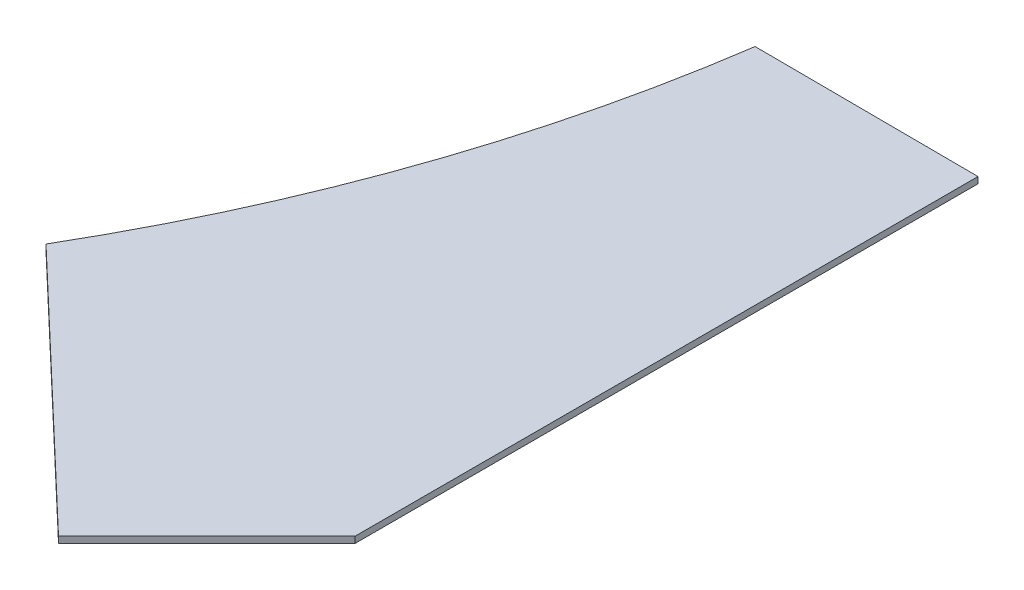
from build123d import *

# Parameters (mm, degrees)
BASEPLATE_PROFILE_DEPTH               = 2
SKETCH2_R                             = 1
M3_PINS_DEPTH                         = 5
M3_PINS_TAPER                         = 7
CIRPATTERN1_COUNT                     = 32
SKETCH4_R                             = 1
PILLAR_PINS_DEPTH                     = 5
PILLAR_PINS_DRAFT                     = 6
PILLAR_PINS_PROFILE_2_DEPTH           = 5
PILLAR_PINS_PROFILE_2_DRAFT           = 6
CIRPATTERN2_COPY_1_SKETCH_R           = 1
CIRPATTERN2_COPY_1_DEPTH              = 5
CIRPATTERN2_COPY_1_DRAFT              = 6
CIRPATTERN2_COPY_2_SKETCH_R           = 1
CIRPATTERN2_COPY_2_DEPTH              = 5
CIRPATTERN2_COPY_2_DRAFT              = 6
CIRPATTERN2_COPY_3_SKETCH_R           = 1
CIRPATTERN2_COPY_3_DEPTH              = 5
CIRPATTERN2_COPY_3_DRAFT              = 6
CIRPATTERN2_COPY_4_SKETCH_R           = 1
CIRPATTERN2_COPY_4_DEPTH              = 5
CIRPATTERN2_COPY_4_DRAFT              = 6
CIRPATTERN2_COPY_5_SKETCH_R           = 1
CIRPATTERN2_COPY_5_DEPTH              = 5
CIRPATTERN2_COPY_5_DRAFT              = 6
CIRPATTERN2_COPY_6_SKETCH_R           = 1
CIRPATTERN2_COPY_6_DEPTH              = 5
CIRPATTERN2_COPY_6_DRAFT              = 6
CIRPATTERN2_COPY_7_SKETCH_R           = 1
CIRPATTERN2_COPY_7_DEPTH              = 5
CIRPATTERN2_COPY_7_DRAFT              = 6
CIRPATTERN2_COPY_8_SKETCH_R           = 1
CIRPATTERN2_COPY_8_DEPTH              = 5
CIRPATTERN2_COPY_8_DRAFT              = 6
CIRPATTERN2_COPY_9_SKETCH_R           = 1
CIRPATTERN2_COPY_9_DEPTH              = 5
CIRPATTERN2_COPY_9_DRAFT              = 6
CIRPATTERN2_COPY_10_SKETCH_R          = 1
CIRPATTERN2_COPY_10_DEPTH             = 5
CIRPATTERN2_COPY_10_DRAFT             = 6
CIRPATTERN2_COPY_11_SKETCH_R          = 1
CIRPATTERN2_COPY_11_DEPTH             = 5
CIRPATTERN2_COPY_11_DRAFT             = 6
CIRPATTERN2_COPY_12_SKETCH_R          = 1
CIRPATTERN2_COPY_12_DEPTH             = 5
CIRPATTERN2_COPY_12_DRAFT             = 6
CIRPATTERN2_COPY_13_SKETCH_R          = 1
CIRPATTERN2_COPY_13_DEPTH             = 5
CIRPATTERN2_COPY_13_DRAFT             = 6
CIRPATTERN2_COPY_14_SKETCH_R          = 1
CIRPATTERN2_COPY_14_DEPTH             = 5
CIRPATTERN2_COPY_14_DRAFT             = 6
CIRPATTERN2_COPY_15_SKETCH_R          = 1
CIRPATTERN2_COPY_15_DEPTH             = 5
CIRPATTERN2_COPY_15_DRAFT             = 6
SKETCH5_R                             = 3
M8_HOLE_1_DEPTH                       = 5
M8_HOLE_1_TAPER                       = 12
M8_1_PATTERN_COUNT                    = 4
SKETCH6_R                             = 3
EXTRUDE_M8_2_DEPTH                    = 5
EXTRUDE_M8_2_TAPER                    = 12
M8_2_PATTERN_COUNT                    = 4
PATTERN_CIRCULAR_M8_3_COUNT           = 2
PATTERN_CIRCULAR_M8_3_ANGLE           = 36.9
PATTERN_CIRCULAR_M8_3_COPY_1_SKETCH_R = 3
PATTERN_CIRCULAR_M8_3_COPY_1_DEPTH    = 5
PATTERN_CIRCULAR_M8_3_COPY_1_TAPER    = 12
PATTERN_CIRCULAR_M8_3_COPY_2_SKETCH_R = 3
PATTERN_CIRCULAR_M8_3_COPY_2_DEPTH    = 5
PATTERN_CIRCULAR_M8_3_COPY_2_TAPER    = 12
PATTERN_CIRCULAR_M8_3_COPY_3_SKETCH_R = 3
PATTERN_CIRCULAR_M8_3_COPY_3_DEPTH    = 5
PATTERN_CIRCULAR_M8_3_COPY_3_TAPER    = 12
CUT_CENTER_DEPTH                      = 374.385859402
CIRPATTERN7_COUNT                     = 6
SKETCH16_W                            = 706.015434107
SKETCH16_H                            = 962.246603821
SKETCH16_W_2                          = 199
SKETCH16_H_2                          = 199
CUT_EXTRUDE4_DEPTH                    = 374.417996354
CUT_EXTRUDE5_DEPTH                    = 374.385859402
BOSS_EXTRUDE3_DEPTH                   = 2
BOSS_EXTRUDE4_DEPTH                   = 1
SKETCH21_W                            = 326.425161963
SKETCH21_H                            = 364.538398874
CUT_EXTRUDE6_DEPTH                    = 374.417996354


with BuildPart() as part:
    # Sketch1 → baseplate profile (new body)
    with BuildSketch(Plane(origin=(0, 0, 0), x_dir=(1, 0, 0), z_dir=(0, 1, 0))):
        Polygon((264, 0), (264, 131.98), (131.979594929, 264), (0, 264), (-131.98, 264), (-264, 131.979594929), (-264, 0), (-264, -131.98), (-131.979594929, -264), (0, -264), (131.98, -264), (264, -131.979594929), align=None)
    extrude(amount=-BASEPLATE_PROFILE_DEPTH)

    # Sketch2 → M3 pins (add)
    with BuildSketch(Plane(origin=(0, 0, 0), x_dir=(1, 0, 0), z_dir=(0, 1, 0))):
        with Locations((0, 248)):
            Circle(SKETCH2_R)
    m3_pins = extrude(amount=M3_PINS_DEPTH, taper=M3_PINS_TAPER)

    # CirPattern1: M3 pins ×32 about axis
    cirpattern1_axis = Axis((0, 0, 0), (0, 1, 0))
    for i in range(1, CIRPATTERN1_COUNT):
        add(m3_pins.rotate(cirpattern1_axis, i * 360 / CIRPATTERN1_COUNT))


with BuildPart() as pillar_pins_tool:
    # Sketch4 → pillar pins (with draft: the straight prism first)
    with BuildSketch(Plane(origin=(0, 0, 0), x_dir=(1, 0, 0), z_dir=(0, 1, 0))):
        with Locations((9, 201)):
            Circle(SKETCH4_R)
    extrude(amount=PILLAR_PINS_DEPTH)
    # pillar pins: the draft: its side faces are tilted about the plane it starts from
    pillar_pins_sides = [pillar_pins_tool.faces().sort_by_distance(p)[0] for p in [
        (8, 2.5, -201),
    ]]
    draft(pillar_pins_sides, Plane(origin=(0, 0, 0), x_dir=(1, 0, 0), z_dir=(0, 1, 0)), PILLAR_PINS_DRAFT)


with BuildPart() as part_1:
    add(part.part)

    # pillar pins: add pillar_pins_tool
    add(pillar_pins_tool.part)


with BuildPart() as pillar_pins_profile_2_tool:
    # Sketch4 → pillar pins profile 2 (with draft: the straight prism first)
    with BuildSketch(Plane(origin=(0, 0, 0), x_dir=(1, 0, 0), z_dir=(0, 1, 0))):
        with Locations((-9, 201)):
            Circle(SKETCH4_R)
    extrude(amount=PILLAR_PINS_PROFILE_2_DEPTH)
    # pillar pins profile 2: the draft: its side faces are tilted about the plane it starts from
    pillar_pins_profile_2_sides = [pillar_pins_profile_2_tool.faces().sort_by_distance(p)[0] for p in [
        (-10, 2.5, -201),
    ]]
    draft(pillar_pins_profile_2_sides, Plane(origin=(0, 0, 0), x_dir=(1, 0, 0), z_dir=(0, 1, 0)), PILLAR_PINS_PROFILE_2_DRAFT)


with BuildPart() as part_2:
    add(part_1.part)

    # pillar pins profile 2: add pillar_pins_profile_2_tool
    add(pillar_pins_profile_2_tool.part)


with BuildPart() as cirpattern2_copy_1_tool:
    # CirPattern2 copy 1 sketch → CirPattern2 copy 1 (with draft: the straight prism first)
    with BuildSketch(Plane(origin=(0, 0, 0), x_dir=(0.5000000000000001, 0, -0.8660254037844386), z_dir=(0, 1, 0))):
        with Locations((9, 201)):
            Circle(CIRPATTERN2_COPY_1_SKETCH_R)
    extrude(amount=CIRPATTERN2_COPY_1_DEPTH)
    # CirPattern2 copy 1: the draft: its side faces are tilted about the plane it starts from
    cirpattern2_copy_1_sides = [cirpattern2_copy_1_tool.faces().sort_by_distance(p)[0] for p in [
        (-170.071106161, 2.5, -107.42820323),
    ]]
    draft(cirpattern2_copy_1_sides, Plane(origin=(0, 0, 0), x_dir=(0.5000000000000001, 0, -0.8660254037844386), z_dir=(0, 1, 0)), CIRPATTERN2_COPY_1_DRAFT)


with BuildPart() as part_3:
    add(part_2.part)

    # CirPattern2 copy 1: add cirpattern2_copy_1_tool
    add(cirpattern2_copy_1_tool.part)


with BuildPart() as cirpattern2_copy_2_tool:
    # CirPattern2 copy 2 sketch → CirPattern2 copy 2 (with draft: the straight prism first)
    with BuildSketch(Plane(origin=(0, 0, 0), x_dir=(-0.4999999999999998, 0, -0.8660254037844387), z_dir=(0, 1, 0))):
        with Locations((9, 201)):
            Circle(CIRPATTERN2_COPY_2_SKETCH_R)
    extrude(amount=CIRPATTERN2_COPY_2_DEPTH)
    # CirPattern2 copy 2: the draft: its side faces are tilted about the plane it starts from
    cirpattern2_copy_2_sides = [cirpattern2_copy_2_tool.faces().sort_by_distance(p)[0] for p in [
        (-178.071106161, 2.5, 93.57179677),
    ]]
    draft(cirpattern2_copy_2_sides, Plane(origin=(0, 0, 0), x_dir=(-0.4999999999999998, 0, -0.8660254037844387), z_dir=(0, 1, 0)), CIRPATTERN2_COPY_2_DRAFT)


with BuildPart() as part_4:
    add(part_3.part)

    # CirPattern2 copy 2: add cirpattern2_copy_2_tool
    add(cirpattern2_copy_2_tool.part)


with BuildPart() as cirpattern2_copy_3_tool:
    # CirPattern2 copy 3 sketch → CirPattern2 copy 3 (with draft: the straight prism first)
    with BuildSketch(Plane(origin=(0, 0, 0), x_dir=(-1, 0, 0), z_dir=(0, 1, 0))):
        with Locations((9, 201)):
            Circle(CIRPATTERN2_COPY_3_SKETCH_R)
    extrude(amount=CIRPATTERN2_COPY_3_DEPTH)
    # CirPattern2 copy 3: the draft: its side faces are tilted about the plane it starts from
    cirpattern2_copy_3_sides = [cirpattern2_copy_3_tool.faces().sort_by_distance(p)[0] for p in [
        (-8, 2.5, 201),
    ]]
    draft(cirpattern2_copy_3_sides, Plane(origin=(0, 0, 0), x_dir=(-1, 0, 0), z_dir=(0, 1, 0)), CIRPATTERN2_COPY_3_DRAFT)


with BuildPart() as part_5:
    add(part_4.part)

    # CirPattern2 copy 3: add cirpattern2_copy_3_tool
    add(cirpattern2_copy_3_tool.part)


with BuildPart() as cirpattern2_copy_4_tool:
    # CirPattern2 copy 4 sketch → CirPattern2 copy 4 (with draft: the straight prism first)
    with BuildSketch(Plane(origin=(0, 0, 0), x_dir=(-0.5000000000000004, 0, 0.8660254037844384), z_dir=(0, 1, 0))):
        with Locations((9, 201)):
            Circle(CIRPATTERN2_COPY_4_SKETCH_R)
    extrude(amount=CIRPATTERN2_COPY_4_DEPTH)
    # CirPattern2 copy 4: the draft: its side faces are tilted about the plane it starts from
    cirpattern2_copy_4_sides = [cirpattern2_copy_4_tool.faces().sort_by_distance(p)[0] for p in [
        (170.071106161, 2.5, 107.42820323),
    ]]
    draft(cirpattern2_copy_4_sides, Plane(origin=(0, 0, 0), x_dir=(-0.5000000000000004, 0, 0.8660254037844384), z_dir=(0, 1, 0)), CIRPATTERN2_COPY_4_DRAFT)


with BuildPart() as part_6:
    add(part_5.part)

    # CirPattern2 copy 4: add cirpattern2_copy_4_tool
    add(cirpattern2_copy_4_tool.part)


with BuildPart() as cirpattern2_copy_5_tool:
    # CirPattern2 copy 5 sketch → CirPattern2 copy 5 (with draft: the straight prism first)
    with BuildSketch(Plane(origin=(0, 0, 0), x_dir=(0.5000000000000001, 0, 0.8660254037844386), z_dir=(0, 1, 0))):
        with Locations((9, 201)):
            Circle(CIRPATTERN2_COPY_5_SKETCH_R)
    extrude(amount=CIRPATTERN2_COPY_5_DEPTH)
    # CirPattern2 copy 5: the draft: its side faces are tilted about the plane it starts from
    cirpattern2_copy_5_sides = [cirpattern2_copy_5_tool.faces().sort_by_distance(p)[0] for p in [
        (178.071106161, 2.5, -93.57179677),
    ]]
    draft(cirpattern2_copy_5_sides, Plane(origin=(0, 0, 0), x_dir=(0.5000000000000001, 0, 0.8660254037844386), z_dir=(0, 1, 0)), CIRPATTERN2_COPY_5_DRAFT)


with BuildPart() as part_7:
    add(part_6.part)

    # CirPattern2 copy 5: add cirpattern2_copy_5_tool
    add(cirpattern2_copy_5_tool.part)


with BuildPart() as cirpattern2_copy_6_tool:
    # CirPattern2 copy 6 sketch → CirPattern2 copy 6 (with draft: the straight prism first)
    with BuildSketch(Plane(origin=(0, 0, 0), x_dir=(0.5000000000000001, 0, -0.8660254037844386), z_dir=(0, 1, 0))):
        with Locations((-9, 201)):
            Circle(CIRPATTERN2_COPY_6_SKETCH_R)
    extrude(amount=CIRPATTERN2_COPY_6_DEPTH)
    # CirPattern2 copy 6: the draft: its side faces are tilted about the plane it starts from
    cirpattern2_copy_6_sides = [cirpattern2_copy_6_tool.faces().sort_by_distance(p)[0] for p in [
        (-179.071106161, 2.5, -91.839745962),
    ]]
    draft(cirpattern2_copy_6_sides, Plane(origin=(0, 0, 0), x_dir=(0.5000000000000001, 0, -0.8660254037844386), z_dir=(0, 1, 0)), CIRPATTERN2_COPY_6_DRAFT)


with BuildPart() as part_8:
    add(part_7.part)

    # CirPattern2 copy 6: add cirpattern2_copy_6_tool
    add(cirpattern2_copy_6_tool.part)


with BuildPart() as cirpattern2_copy_7_tool:
    # CirPattern2 copy 7 sketch → CirPattern2 copy 7 (with draft: the straight prism first)
    with BuildSketch(Plane(origin=(0, 0, 0), x_dir=(-0.4999999999999998, 0, -0.8660254037844387), z_dir=(0, 1, 0))):
        with Locations((-9, 201)):
            Circle(CIRPATTERN2_COPY_7_SKETCH_R)
    extrude(amount=CIRPATTERN2_COPY_7_DEPTH)
    # CirPattern2 copy 7: the draft: its side faces are tilted about the plane it starts from
    cirpattern2_copy_7_sides = [cirpattern2_copy_7_tool.faces().sort_by_distance(p)[0] for p in [
        (-169.071106161, 2.5, 109.160254038),
    ]]
    draft(cirpattern2_copy_7_sides, Plane(origin=(0, 0, 0), x_dir=(-0.4999999999999998, 0, -0.8660254037844387), z_dir=(0, 1, 0)), CIRPATTERN2_COPY_7_DRAFT)


with BuildPart() as part_9:
    add(part_8.part)

    # CirPattern2 copy 7: add cirpattern2_copy_7_tool
    add(cirpattern2_copy_7_tool.part)


with BuildPart() as cirpattern2_copy_8_tool:
    # CirPattern2 copy 8 sketch → CirPattern2 copy 8 (with draft: the straight prism first)
    with BuildSketch(Plane(origin=(0, 0, 0), x_dir=(-1, 0, 0), z_dir=(0, 1, 0))):
        with Locations((-9, 201)):
            Circle(CIRPATTERN2_COPY_8_SKETCH_R)
    extrude(amount=CIRPATTERN2_COPY_8_DEPTH)
    # CirPattern2 copy 8: the draft: its side faces are tilted about the plane it starts from
    cirpattern2_copy_8_sides = [cirpattern2_copy_8_tool.faces().sort_by_distance(p)[0] for p in [
        (10, 2.5, 201),
    ]]
    draft(cirpattern2_copy_8_sides, Plane(origin=(0, 0, 0), x_dir=(-1, 0, 0), z_dir=(0, 1, 0)), CIRPATTERN2_COPY_8_DRAFT)


with BuildPart() as part_10:
    add(part_9.part)

    # CirPattern2 copy 8: add cirpattern2_copy_8_tool
    add(cirpattern2_copy_8_tool.part)


with BuildPart() as cirpattern2_copy_9_tool:
    # CirPattern2 copy 9 sketch → CirPattern2 copy 9 (with draft: the straight prism first)
    with BuildSketch(Plane(origin=(0, 0, 0), x_dir=(-0.5000000000000004, 0, 0.8660254037844384), z_dir=(0, 1, 0))):
        with Locations((-9, 201)):
            Circle(CIRPATTERN2_COPY_9_SKETCH_R)
    extrude(amount=CIRPATTERN2_COPY_9_DEPTH)
    # CirPattern2 copy 9: the draft: its side faces are tilted about the plane it starts from
    cirpattern2_copy_9_sides = [cirpattern2_copy_9_tool.faces().sort_by_distance(p)[0] for p in [
        (179.071106161, 2.5, 91.839745962),
    ]]
    draft(cirpattern2_copy_9_sides, Plane(origin=(0, 0, 0), x_dir=(-0.5000000000000004, 0, 0.8660254037844384), z_dir=(0, 1, 0)), CIRPATTERN2_COPY_9_DRAFT)


with BuildPart() as part_11:
    add(part_10.part)

    # CirPattern2 copy 9: add cirpattern2_copy_9_tool
    add(cirpattern2_copy_9_tool.part)


with BuildPart() as cirpattern2_copy_10_tool:
    # CirPattern2 copy 10 sketch → CirPattern2 copy 10 (with draft: the straight prism first)
    with BuildSketch(Plane(origin=(0, 0, 0), x_dir=(0.5000000000000001, 0, 0.8660254037844386), z_dir=(0, 1, 0))):
        with Locations((-9, 201)):
            Circle(CIRPATTERN2_COPY_10_SKETCH_R)
    extrude(amount=CIRPATTERN2_COPY_10_DEPTH)
    # CirPattern2 copy 10: the draft: its side faces are tilted about the plane it starts from
    cirpattern2_copy_10_sides = [cirpattern2_copy_10_tool.faces().sort_by_distance(p)[0] for p in [
        (169.071106161, 2.5, -109.160254038),
    ]]
    draft(cirpattern2_copy_10_sides, Plane(origin=(0, 0, 0), x_dir=(0.5000000000000001, 0, 0.8660254037844386), z_dir=(0, 1, 0)), CIRPATTERN2_COPY_10_DRAFT)


with BuildPart() as part_12:
    add(part_11.part)

    # CirPattern2 copy 10: add cirpattern2_copy_10_tool
    add(cirpattern2_copy_10_tool.part)


with BuildPart() as cirpattern2_copy_11_tool:
    # CirPattern2 copy 11 sketch → CirPattern2 copy 11 (with draft: the straight prism first)
    with BuildSketch(Plane(origin=(0, 0, 0), x_dir=(0.5000000000000001, 0, -0.8660254037844386), z_dir=(0, 1, 0))):
        with Locations((-9, 201)):
            Circle(CIRPATTERN2_COPY_11_SKETCH_R)
    extrude(amount=CIRPATTERN2_COPY_11_DEPTH)
    # CirPattern2 copy 11: the draft: its side faces are tilted about the plane it starts from
    cirpattern2_copy_11_sides = [cirpattern2_copy_11_tool.faces().sort_by_distance(p)[0] for p in [
        (-179.071106161, 2.5, -91.839745962),
    ]]
    draft(cirpattern2_copy_11_sides, Plane(origin=(0, 0, 0), x_dir=(0.5000000000000001, 0, -0.8660254037844386), z_dir=(0, 1, 0)), CIRPATTERN2_COPY_11_DRAFT)


with BuildPart() as part_13:
    add(part_12.part)

    # CirPattern2 copy 11: add cirpattern2_copy_11_tool
    add(cirpattern2_copy_11_tool.part)


with BuildPart() as cirpattern2_copy_12_tool:
    # CirPattern2 copy 12 sketch → CirPattern2 copy 12 (with draft: the straight prism first)
    with BuildSketch(Plane(origin=(0, 0, 0), x_dir=(-0.4999999999999998, 0, -0.8660254037844387), z_dir=(0, 1, 0))):
        with Locations((-9, 201)):
            Circle(CIRPATTERN2_COPY_12_SKETCH_R)
    extrude(amount=CIRPATTERN2_COPY_12_DEPTH)
    # CirPattern2 copy 12: the draft: its side faces are tilted about the plane it starts from
    cirpattern2_copy_12_sides = [cirpattern2_copy_12_tool.faces().sort_by_distance(p)[0] for p in [
        (-169.071106161, 2.5, 109.160254038),
    ]]
    draft(cirpattern2_copy_12_sides, Plane(origin=(0, 0, 0), x_dir=(-0.4999999999999998, 0, -0.8660254037844387), z_dir=(0, 1, 0)), CIRPATTERN2_COPY_12_DRAFT)


with BuildPart() as part_14:
    add(part_13.part)

    # CirPattern2 copy 12: add cirpattern2_copy_12_tool
    add(cirpattern2_copy_12_tool.part)


with BuildPart() as cirpattern2_copy_13_tool:
    # CirPattern2 copy 13 sketch → CirPattern2 copy 13 (with draft: the straight prism first)
    with BuildSketch(Plane(origin=(0, 0, 0), x_dir=(-1, 0, 0), z_dir=(0, 1, 0))):
        with Locations((-9, 201)):
            Circle(CIRPATTERN2_COPY_13_SKETCH_R)
    extrude(amount=CIRPATTERN2_COPY_13_DEPTH)
    # CirPattern2 copy 13: the draft: its side faces are tilted about the plane it starts from
    cirpattern2_copy_13_sides = [cirpattern2_copy_13_tool.faces().sort_by_distance(p)[0] for p in [
        (10, 2.5, 201),
    ]]
    draft(cirpattern2_copy_13_sides, Plane(origin=(0, 0, 0), x_dir=(-1, 0, 0), z_dir=(0, 1, 0)), CIRPATTERN2_COPY_13_DRAFT)


with BuildPart() as part_15:
    add(part_14.part)

    # CirPattern2 copy 13: add cirpattern2_copy_13_tool
    add(cirpattern2_copy_13_tool.part)


with BuildPart() as cirpattern2_copy_14_tool:
    # CirPattern2 copy 14 sketch → CirPattern2 copy 14 (with draft: the straight prism first)
    with BuildSketch(Plane(origin=(0, 0, 0), x_dir=(-0.5000000000000004, 0, 0.8660254037844384), z_dir=(0, 1, 0))):
        with Locations((-9, 201)):
            Circle(CIRPATTERN2_COPY_14_SKETCH_R)
    extrude(amount=CIRPATTERN2_COPY_14_DEPTH)
    # CirPattern2 copy 14: the draft: its side faces are tilted about the plane it starts from
    cirpattern2_copy_14_sides = [cirpattern2_copy_14_tool.faces().sort_by_distance(p)[0] for p in [
        (179.071106161, 2.5, 91.839745962),
    ]]
    draft(cirpattern2_copy_14_sides, Plane(origin=(0, 0, 0), x_dir=(-0.5000000000000004, 0, 0.8660254037844384), z_dir=(0, 1, 0)), CIRPATTERN2_COPY_14_DRAFT)


with BuildPart() as part_16:
    add(part_15.part)

    # CirPattern2 copy 14: add cirpattern2_copy_14_tool
    add(cirpattern2_copy_14_tool.part)


with BuildPart() as cirpattern2_copy_15_tool:
    # CirPattern2 copy 15 sketch → CirPattern2 copy 15 (with draft: the straight prism first)
    with BuildSketch(Plane(origin=(0, 0, 0), x_dir=(0.5000000000000001, 0, 0.8660254037844386), z_dir=(0, 1, 0))):
        with Locations((-9, 201)):
            Circle(CIRPATTERN2_COPY_15_SKETCH_R)
    extrude(amount=CIRPATTERN2_COPY_15_DEPTH)
    # CirPattern2 copy 15: the draft: its side faces are tilted about the plane it starts from
    cirpattern2_copy_15_sides = [cirpattern2_copy_15_tool.faces().sort_by_distance(p)[0] for p in [
        (169.071106161, 2.5, -109.160254038),
    ]]
    draft(cirpattern2_copy_15_sides, Plane(origin=(0, 0, 0), x_dir=(0.5000000000000001, 0, 0.8660254037844386), z_dir=(0, 1, 0)), CIRPATTERN2_COPY_15_DRAFT)


with BuildPart() as part_17:
    add(part_16.part)

    # CirPattern2 copy 15: add cirpattern2_copy_15_tool
    add(cirpattern2_copy_15_tool.part)

    # Sketch5 → M8 hole -1 (add)
    with BuildSketch(Plane(origin=(0, 0, 0), x_dir=(1, 0, 0), z_dir=(0, 1, 0))):
        with Locations((-193.040151264, 193.040151264)):
            Circle(SKETCH5_R)
    m8_hole_1 = extrude(amount=M8_HOLE_1_DEPTH, taper=M8_HOLE_1_TAPER)

    # M8 -1 pattern: M8 hole -1 ×4 about axis
    m8_1_pattern_axis = Axis((0, 0, 0), (0, 1, 0))
    for i in range(1, M8_1_PATTERN_COUNT):
        add(m8_hole_1.rotate(m8_1_pattern_axis, i * 360 / M8_1_PATTERN_COUNT))

    # Sketch6 → M8 -2 (add)
    with BuildSketch(Plane(origin=(0, 0, 0), x_dir=(1, 0, 0), z_dir=(0, 1, 0))):
        with Locations((-125, -250)):
            Circle(SKETCH6_R)
    extrude_m8_2 = extrude(amount=EXTRUDE_M8_2_DEPTH, taper=EXTRUDE_M8_2_TAPER)

    # M8 -2 pattern: M8 -2 ×4 about axis
    m8_2_pattern_axis = Axis((0, 0, 0), (0, 1, 0))
    for i in range(1, M8_2_PATTERN_COUNT):
        add(extrude_m8_2.rotate(m8_2_pattern_axis, i * 360 / M8_2_PATTERN_COUNT))

    # M8 -3: M8 -2 ×2 about axis
    pattern_circular_m8_3_axis = Axis((0, 0, 0), (0, -1, 0))
    for i in range(1, PATTERN_CIRCULAR_M8_3_COUNT):
        add(extrude_m8_2.rotate(pattern_circular_m8_3_axis, i * PATTERN_CIRCULAR_M8_3_ANGLE / (PATTERN_CIRCULAR_M8_3_COUNT - 1)))

    # M8 -3 copy 1 sketch → M8 -3 copy 1 (add)
    with BuildSketch(Plane(origin=(0, 0, 0), x_dir=(0.6004202253258852, 0, -0.7996846584870897), z_dir=(0, 1, 0))):
        with Locations((-125, -250)):
            Circle(PATTERN_CIRCULAR_M8_3_COPY_1_SKETCH_R)
    extrude(amount=PATTERN_CIRCULAR_M8_3_COPY_1_DEPTH, taper=PATTERN_CIRCULAR_M8_3_COPY_1_TAPER)

    # M8 -3 copy 2 sketch → M8 -3 copy 2 (add)
    with BuildSketch(Plane(origin=(0, 0, 0), x_dir=(-0.7996846584870896, 0, -0.6004202253258853), z_dir=(0, 1, 0))):
        with Locations((-125, -250)):
            Circle(PATTERN_CIRCULAR_M8_3_COPY_2_SKETCH_R)
    extrude(amount=PATTERN_CIRCULAR_M8_3_COPY_2_DEPTH, taper=PATTERN_CIRCULAR_M8_3_COPY_2_TAPER)

    # M8 -3 copy 3 sketch → M8 -3 copy 3 (add)
    with BuildSketch(Plane(origin=(0, 0, 0), x_dir=(-0.6004202253258853, 0, 0.7996846584870896), z_dir=(0, 1, 0))):
        with Locations((-125, -250)):
            Circle(PATTERN_CIRCULAR_M8_3_COPY_3_SKETCH_R)
    extrude(amount=PATTERN_CIRCULAR_M8_3_COPY_3_DEPTH, taper=PATTERN_CIRCULAR_M8_3_COPY_3_TAPER)

    # Sketch8 → cut center (cut, through all)
    with BuildSketch(Plane(origin=(0, 0, 0), x_dir=(1, 0, 0), z_dir=(0, 1, 0))):
        with BuildLine():
            Line((115.433963806, -199.937490231), (0, 0))
            Line((0, 0), (0, -180))
            Line((0, -180), (20, -180))
            Line((20, -180), (20, -230))
            ThreePointArc((20, -230), (69.365180469, -220.200980331), (115.433963806, -199.937490231))
        make_face()
        with BuildLine():
            Line((0, -180), (0, 0))
            Line((0, 0), (-115.433963806, -199.937490231))
            ThreePointArc((-115.433963806, -199.937490231), (-69.365180469, -220.200980331), (-20, -230))
            Line((-20, -230), (-20, -180))
            Line((-20, -180), (0, -180))
        make_face()
    cut_center = extrude(amount=-CUT_CENTER_DEPTH, mode=Mode.SUBTRACT)

    # CirPattern7: cut center ×6 about axis
    cirpattern7_axis = Axis((0, 0, 0), (0, 1, 0))
    for i in range(1, CIRPATTERN7_COUNT):
        add(cut_center.rotate(cirpattern7_axis, i * 360 / CIRPATTERN7_COUNT), mode=Mode.SUBTRACT)

    # Sketch16 → Cut-Extrude4 (cut, through all)
    with BuildSketch(Plane.XZ.offset(2)):
        with Locations((12.105337572, -26.075320592)):
            Rectangle(SKETCH16_W, SKETCH16_H)
        with Locations((190.5, 190.5)):
            Rectangle(SKETCH16_W_2, SKETCH16_H_2, mode=Mode.SUBTRACT)
    extrude(amount=-CUT_EXTRUDE4_DEPTH, mode=Mode.SUBTRACT)

    # Sketch17 → Cut-Extrude5 (cut, through all)
    with BuildSketch(Plane(origin=(0, 0, 0), x_dir=(1, 0, 0), z_dir=(0, 1, 0))):
        Polygon((81, -244), (96, -252.660254038), (96, -235.339745962), align=None)
    extrude(amount=-CUT_EXTRUDE5_DEPTH, mode=Mode.SUBTRACT)

    # Sketch19 → Boss-Extrude3 (add)
    with BuildSketch(Plane(origin=(0, -2, 0), x_dir=(-1, 0, 0), z_dir=(0, -1, 0))):
        Polygon((-235.339745962, -86), (-252.660254038, -86), (-244, -101), align=None)
    extrude(amount=-BOSS_EXTRUDE3_DEPTH)

    # Sketch20 → Boss-Extrude4 (add)
    with BuildSketch(Plane.XZ.offset(2)):
        with BuildLine():
            Line((240.494949993, 155.484717056), (264, 131.979594929))
            Line((264, 131.979594929), (264, 33.229825763))
            Line((264, 33.229825763), (228.489590239, 33.05309596))
            ThreePointArc((228.489590239, 33.05309596), (217.960347438, 76.113644932), (199.3952958, 116.368019717))
            Line((199.3952958, 116.368019717), (240.494949993, 155.484717056))
        make_face()
    extrude(amount=BOSS_EXTRUDE4_DEPTH)

    # Sketch21 → Cut-Extrude6 (cut, through all)
    with BuildSketch(Plane.XZ.offset(2)):
        with Locations((202.532221133, 140.310862517)):
            Rectangle(SKETCH21_W, SKETCH21_H)
    extrude(amount=-CUT_EXTRUDE6_DEPTH, mode=Mode.SUBTRACT)


solid = part_17.part
